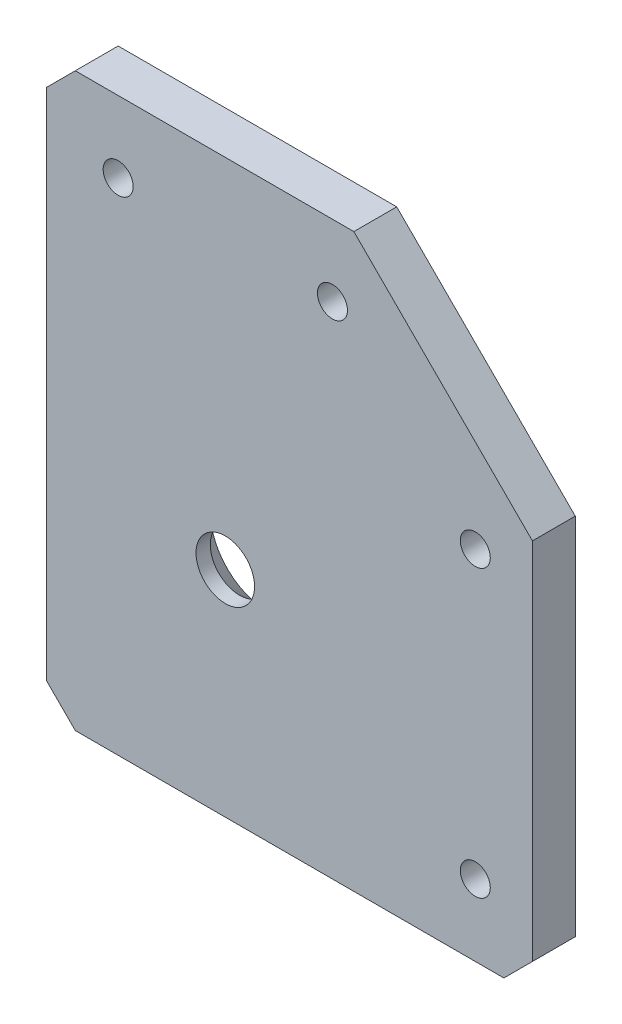
from build123d import *

# Parameters (mm, degrees)
SKETCH_1_W      = 68
SKETCH_1_H      = 80
SKETCH_1_R      = 4.1
SKETCH_1_R_2    = 2.1
EXTRUDE_1_DEPTH = 3
CHAMFER_1_SIZE  = 25
CHAMFER_2_SIZE  = 4
CHAMFER_3_SIZE  = 2


with BuildPart() as part:
    # 草图1 → 凸台-拉伸1 (new, symmetric)
    with BuildSketch(Plane.XY):
        with Locations((9, 10)):
            Rectangle(SKETCH_1_W, SKETCH_1_H)
        Circle(SKETCH_1_R, mode=Mode.SUBTRACT)
        with Locations((35, 20)):
            Circle(SKETCH_1_R_2, mode=Mode.SUBTRACT)
        with Locations((35, -20)):
            Circle(SKETCH_1_R_2, mode=Mode.SUBTRACT)
        with Locations((-15, 40)):
            Circle(SKETCH_1_R_2, mode=Mode.SUBTRACT)
        with Locations((15, 40)):
            Circle(SKETCH_1_R_2, mode=Mode.SUBTRACT)
    extrude(amount=EXTRUDE_1_DEPTH, both=True)

    # 倒角1
    chamfer_1_edges = [part.edges().sort_by_distance(p)[0] for p in [
        (43, 50, 0),
    ]]
    chamfer(chamfer_1_edges, length=CHAMFER_1_SIZE)

    # 倒角2
    chamfer_2_edges = [part.edges().sort_by_distance(p)[0] for p in [
        (-4.1, 0, -3),
        (-25, 50, 0),
        (43, -30, 0),
        (-25, -30, 0),
    ]]
    chamfer(chamfer_2_edges, length=CHAMFER_2_SIZE)

    # 倒角3
    chamfer_3_edges = [part.edges().sort_by_distance(p)[0] for p in [
        (32.9, 20, -3),
        (32.9, -20, -3),
        (-17.1, 40, -3),
        (12.9, 40, -3),
    ]]
    chamfer(chamfer_3_edges, length=CHAMFER_3_SIZE)


solid = part.part
